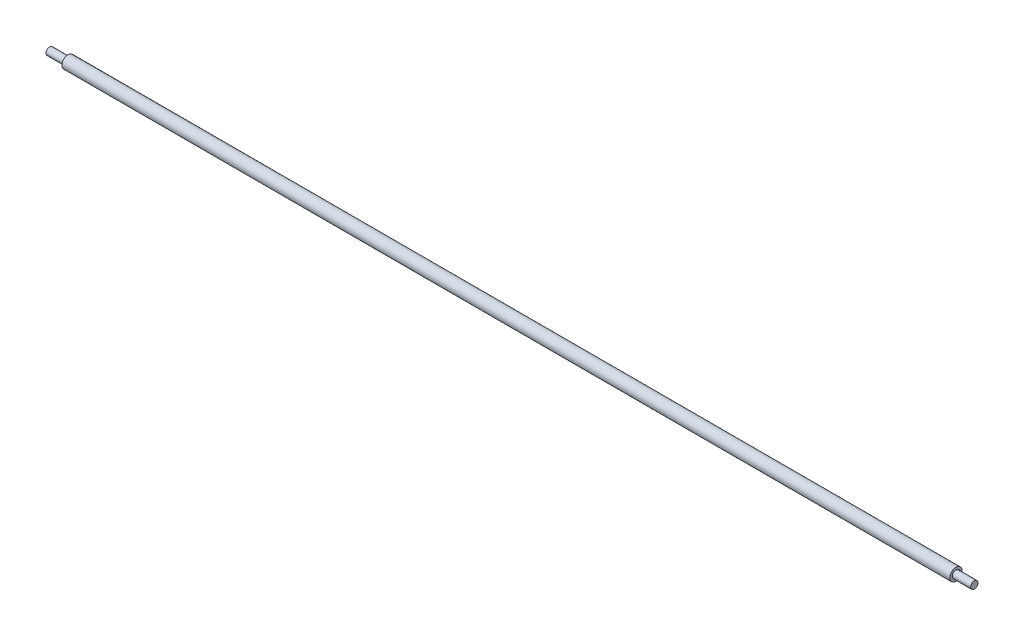
from build123d import *

# Parameters (mm, degrees)
EXTRUDE_1_DEPTH      = 455
EXTRUDE_1_DEPTH_BACK = 270
SKETCH_1_R           = 5
SKETCH_2_R           = 3
EXTRUDE_2_DEPTH      = 15
EXTRUDE_START        = 15
SKETCH_7_R           = 3
EXTRUDE_3_DEPTH      = 15


with BuildPart() as part:
    # Эскиз1 → Бобышка-Вытянуть1 (new, two sides: drawn at the far end of the back side and taken through both)
    with BuildSketch(Plane(origin=(0, 0, 0), x_dir=(0, 0, -1), z_dir=(1, 0, 0)).offset(-EXTRUDE_1_DEPTH_BACK)):
        Circle(SKETCH_1_R)
    extrude(amount=EXTRUDE_1_DEPTH + EXTRUDE_1_DEPTH_BACK)

    # Эскиз2 → Бобышка-Вытянуть2 (add)
    with BuildSketch(Plane.ZY.offset(270)):
        Circle(SKETCH_2_R)
    extrude(amount=EXTRUDE_2_DEPTH)

    # Эскиз7 → Бобышка-Вытянуть3 (add)
    with BuildSketch(Plane(origin=(455, 0, 0), x_dir=(0, 0, -1), z_dir=(1, 0, 0)).offset(EXTRUDE_START)):
        with Locations(Location((0, 0, 0), (0, 0, 180))):
            Circle(SKETCH_7_R)
    extrude(amount=-EXTRUDE_3_DEPTH)


solid = part.part
